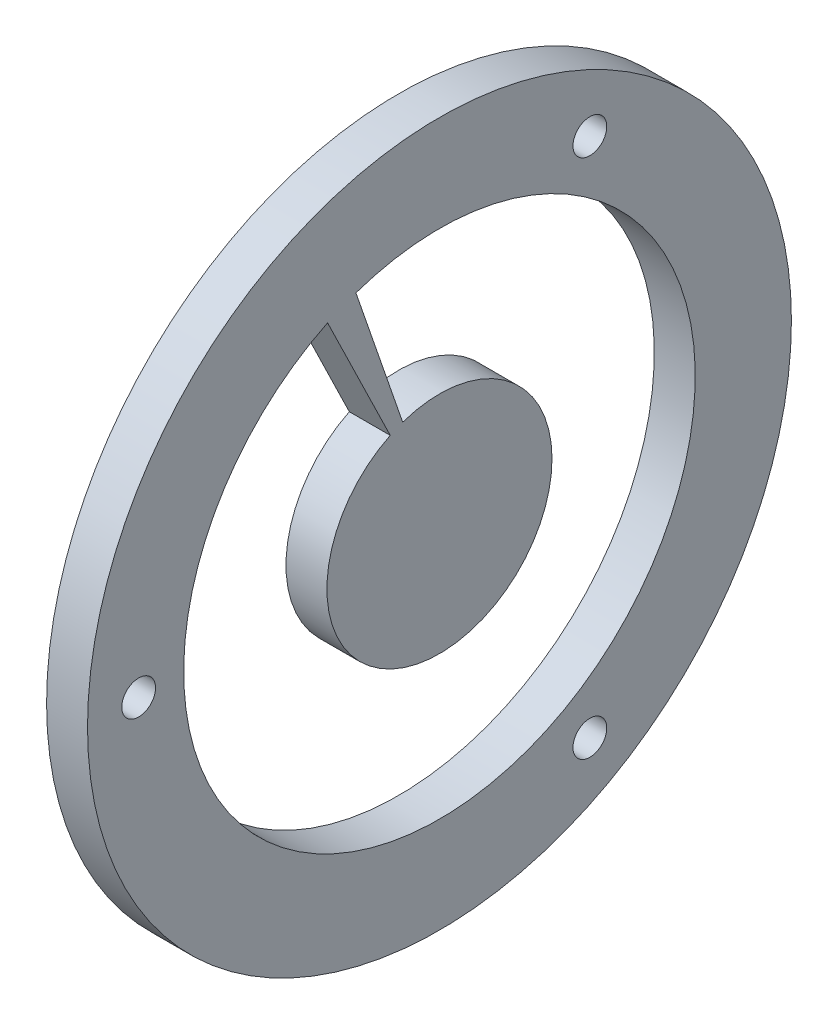
from build123d import *

# Parameters (mm, degrees)
AXIAL_PROFILE_MM_W                                  = 4
AXIAL_PROFILE_MM_H                                  = 34.4
AXIAL_HOLES_DEPTH                                   = 171.775905795
AXIAL_HOLES_DEPTH_BACK                              = 171.775905795
SKETCH2_R                                           = 1.65
C_SHAPED_COOLANT_PASSAGE_AND_INTEGRAL_DI_DEPTH      = 171.775905795
C_SHAPED_COOLANT_PASSAGE_AND_INTEGRAL_DI_DEPTH_BACK = 171.775905795


with BuildPart() as part:
    # Axial profile (mm) → Full revolution (revolve)
    with BuildSketch(Plane.XY, mode=Mode.PRIVATE) as full_revolution_sk:
        with Locations((161.7, 17.2)):
            Rectangle(AXIAL_PROFILE_MM_W, AXIAL_PROFILE_MM_H)
    revolve(full_revolution_sk.sketch.rotate(Axis((-110, 0, 0), (1, 0, 0)), 90), axis=Axis((-110, 0, 0), (1, 0, 0)))

    # Sketch2 → Axial holes (cut, two sides: drawn at the far end of the back side and taken through both)
    with BuildSketch(Plane(origin=(0, 0, 0), x_dir=(0, 0, -1), z_dir=(1, 0, 0)).offset(-AXIAL_HOLES_DEPTH_BACK)):
        with Locations((-29.4, 0)):
            Circle(SKETCH2_R)
        with Locations((14.7, -25.461146871)):
            Circle(SKETCH2_R)
        with Locations((14.7, 25.461146871)):
            Circle(SKETCH2_R)
    extrude(amount=AXIAL_HOLES_DEPTH + AXIAL_HOLES_DEPTH_BACK, mode=Mode.SUBTRACT)

    # Sketch3 → C-shaped coolant passage and integral divider (cut, two sides: drawn at the far end of the back side and taken through both)
    with BuildSketch(Plane(origin=(0, 0, 0), x_dir=(0, 0, -1), z_dir=(1, 0, 0)).offset(-C_SHAPED_COOLANT_PASSAGE_AND_INTEGRAL_DI_DEPTH_BACK)):
        with BuildLine():
            Line((-10.934858177, 22.481745409), (-4.811337598, 9.89196798))
            ThreePointArc((-4.811337598, 9.89196798), (4.209517756, -10.162674858), (-3.592548196, 10.39680708))
            Line((-3.592548196, 10.39680708), (-8.164882263, 23.629107))
            ThreePointArc((-8.164882263, 23.629107), (9.567085809, -23.096988313), (-10.934858177, 22.481745409))
        make_face()
    extrude(amount=C_SHAPED_COOLANT_PASSAGE_AND_INTEGRAL_DI_DEPTH + C_SHAPED_COOLANT_PASSAGE_AND_INTEGRAL_DI_DEPTH_BACK, mode=Mode.SUBTRACT)


solid = part.part
